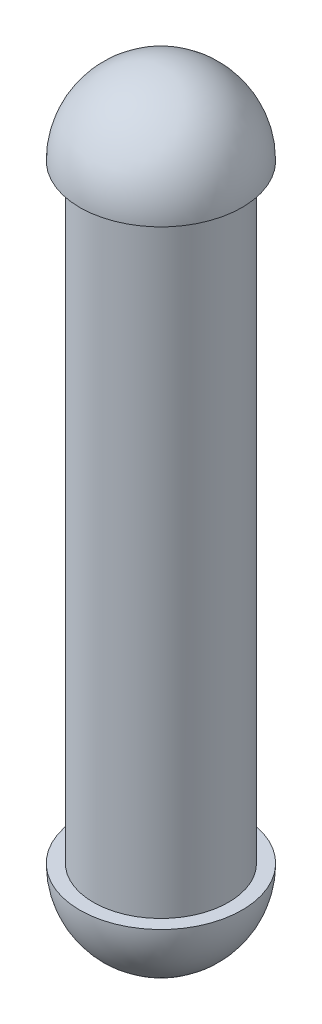
from build123d import *

# Parameters (mm, degrees)
SKETCH1_R           = 1
BOSS_EXTRUDE1_DEPTH = 4.5
REVOLVE1_ANGLE      = 180


with BuildPart() as part:
    # Sketch1 → Boss-Extrude1 (new, symmetric)
    with BuildSketch(Plane(origin=(0, 0, 0), x_dir=(1, 0, 0), z_dir=(0, 1, 0))):
        with Locations(Location((0, 0, 0), (0, 0, 270))):
            Circle(SKETCH1_R)
    extrude(amount=BOSS_EXTRUDE1_DEPTH, both=True)

    # Sketch2 → Revolve1 (revolve)
    with BuildSketch(Plane(origin=(0, 4.5, 0), x_dir=(1, 0, 0), z_dir=(0, 1, 0))):
        with BuildLine():
            Line((0, 1.2), (0, -1.2))
            ThreePointArc((0, -1.2), (-1.2, 0), (0, 1.2))
        make_face()
    revolve1 = revolve(axis=Axis((0, 4.5, -1.2), (0, 0, -1)), revolution_arc=REVOLVE1_ANGLE)

    # Mirror1: Revolve1 across plane
    add(revolve1.mirror(Plane.ZX))


solid = part.part
